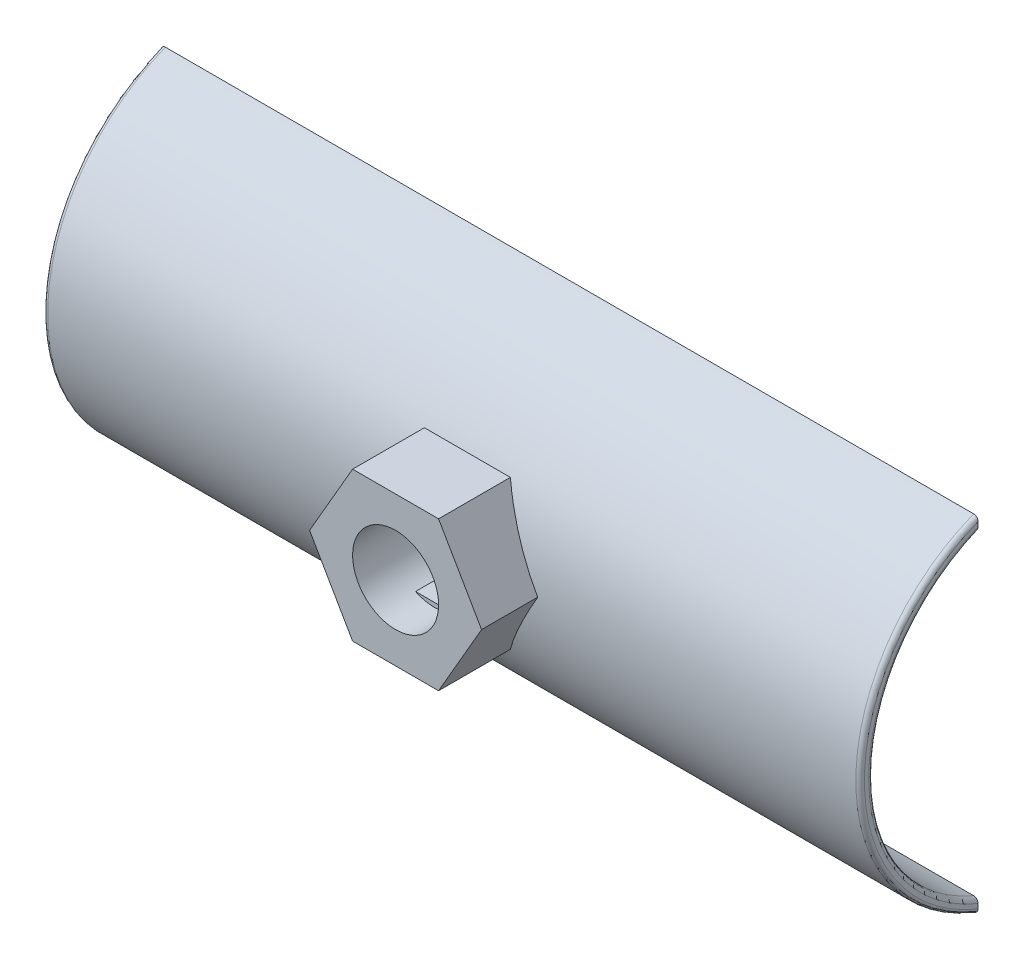
from build123d import *

# Parameters (mm, degrees)
BOSS_EXTRUDE1_DEPTH      = 20
CUT_EXTRUDE1_DEPTH       = 11
SKETCH4_R                = 10
CUT_EXTRUDE2_DEPTH       = 11
BOSS_EXTRUDE2_DEPTH      = 95
BOSS_EXTRUDE2_DEPTH_BACK = 95
SKETCH6_R                = 40
CUT_EXTRUDE3_DEPTH       = 196.258176901
CUT_EXTRUDE4_DEPTH       = 108.806733567
FILLET1_R                = 1


with BuildPart() as part:
    # Sketch1 → Boss-Extrude1 (new body)
    with BuildSketch(Plane.XY):
        Polygon((10, -17.320508076), (20, 0), (10, 17.320508076), (-10, 17.320508076), (-20, 0), (-10, -17.320508076), align=None)
    extrude(amount=BOSS_EXTRUDE1_DEPTH)

    # Sketch3 → Cut-Extrude1 (cut)
    with BuildSketch(Plane(origin=(0, 0, 0), x_dir=(-1, 0, 0), z_dir=(0, 0, -1))):
        with BuildLine():
            Line((4.358898944, 9), (-4.358898944, 9))
            ThreePointArc((-4.358898944, 9), (-10, 0), (-4.358898944, -9))
            Line((-4.358898944, -9), (4.358898944, -9))
            ThreePointArc((4.358898944, -9), (8.473163206, -5.310885546), (10, 0))
            ThreePointArc((10, 0), (8.473163206, 5.310885546), (4.358898944, 9))
        make_face()
    extrude(amount=-CUT_EXTRUDE1_DEPTH, mode=Mode.SUBTRACT)

    # Sketch4 → Cut-Extrude2 (cut)
    with BuildSketch(Plane(origin=(0, 0, 11), x_dir=(-1, 0, 0), z_dir=(0, 0, -1))):
        Circle(SKETCH4_R)
    extrude(amount=-CUT_EXTRUDE2_DEPTH, mode=Mode.SUBTRACT)

    # Sketch5 → Boss-Extrude2 (add, two sides: drawn at the far end of the back side and taken through both)
    with BuildSketch(Plane(origin=(0, 0, 0), x_dir=(0, 0, -1), z_dir=(1, 0, 0)).offset(-BOSS_EXTRUDE2_DEPTH_BACK)):
        with BuildLine():
            Line((20.478916174, 40.079541402), (20.478916174, 36.84249773))
            ThreePointArc((20.478916174, 36.84249773), (-3.944487245, 0), (20.478916174, -36.84249773))
            Line((20.478916174, -36.84249773), (20.478916174, -40.079541402))
            ThreePointArc((20.478916174, -40.079541402), (-6.944487245, 0), (20.478916174, 40.079541402))
        make_face()
    extrude(amount=BOSS_EXTRUDE2_DEPTH + BOSS_EXTRUDE2_DEPTH_BACK)

    # Sketch6 → Cut-Extrude3 (cut, through all)
    with BuildSketch(Plane(origin=(95, 0, 0), x_dir=(0, 0, -1), z_dir=(1, 0, 0))):
        with Locations((36.055512755, 0)):
            Circle(SKETCH6_R)
    extrude(amount=-CUT_EXTRUDE3_DEPTH, mode=Mode.SUBTRACT)

    # Sketch7 → Cut-Extrude4 (cut, through all)
    with BuildSketch(Plane.XY.offset(11)):
        with BuildLine():
            Line((-4.358898944, 9), (4.358898944, 9))
            ThreePointArc((4.358898944, 9), (10, 0), (4.358898944, -9))
            Line((4.358898944, -9), (-4.358898944, -9))
            ThreePointArc((-4.358898944, -9), (-10, 0), (-4.358898944, 9))
        make_face()
    extrude(amount=-CUT_EXTRUDE4_DEPTH, mode=Mode.SUBTRACT)

    # Fillet1
    fillet1_edges = [part.edges().sort_by_distance(p)[0] for p in [
        (-95, 0, 6.944487245),
        (-95, 0, 3.944487245),
        (95, 0, 6.944487245),
        (95, 0, 3.944487245),
    ]]
    fillet(fillet1_edges, radius=FILLET1_R)


solid = part.part
